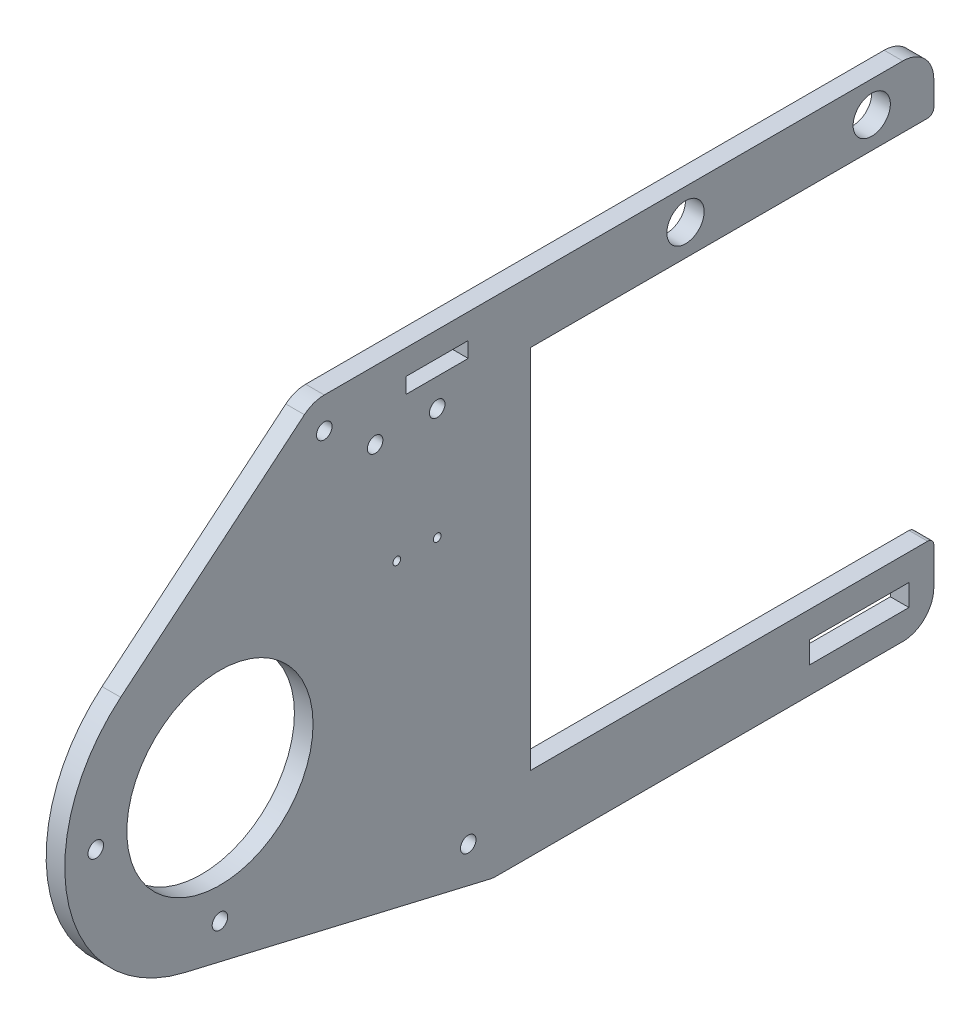
from build123d import *

# Parameters (mm, degrees)
SKETCH1_R           = 15
SKETCH1_R_2         = 3
SKETCH1_R_3         = 1.25
SKETCH1_R_4         = 0.625
SKETCH1_W           = 10
SKETCH1_H           = 2.5
SKETCH1_W_2         = 16
SKETCH1_H_2         = 3.5
BOSS_EXTRUDE1_DEPTH = 3
FILLET1_R           = 5
FILLET2_R           = 1


with BuildPart() as part:
    # Sketch1 → Boss-Extrude1 (new body)
    with BuildSketch(Plane(origin=(0, 0, 0), x_dir=(0, 0, -1), z_dir=(1, 0, 0))):
        with BuildLine():
            Line((0, 5), (65, 5))
            Line((65, 5), (65, 15))
            Line((65, 15), (-35, 15))
            Line((-35, 15), (-65.988977704, -10.781451876))
            ThreePointArc((-65.988977704, -10.781451876), (-74.331609313, -35.742193679), (-55.709440186, -54.339315783))
            Line((-55.709440186, -54.339315783), (-6, -66))
            Line((-6, -66), (65, -66))
            Line((65, -66), (65, -54))
            Line((65, -54), (0, -54))
            Line((0, -54), (0, 5))
        make_face()
        with Locations((-50, -30)):
            Circle(SKETCH1_R, mode=Mode.SUBTRACT)
        with Locations((55, 10)):
            Circle(SKETCH1_R_2, mode=Mode.SUBTRACT)
        with Locations((25, 10)):
            Circle(SKETCH1_R_2, mode=Mode.SUBTRACT)
        with Locations((-33.192050804, 10)):
            Circle(SKETCH1_R_3, mode=Mode.SUBTRACT)
        with Locations((-50, -50)):
            Circle(SKETCH1_R_3, mode=Mode.SUBTRACT)
        with Locations((-70, -30)):
            Circle(SKETCH1_R_3, mode=Mode.SUBTRACT)
        with Locations((-10, -59.255419511)):
            Circle(SKETCH1_R_3, mode=Mode.SUBTRACT)
        with Locations((-25, 4)):
            Circle(SKETCH1_R_3, mode=Mode.SUBTRACT)
        with Locations((-15, 4)):
            Circle(SKETCH1_R_3, mode=Mode.SUBTRACT)
        with Locations((-15, -14)):
            Circle(SKETCH1_R_4, mode=Mode.SUBTRACT)
        with Locations((-21.5, -14)):
            Circle(SKETCH1_R_4, mode=Mode.SUBTRACT)
        with Locations((-15, 9.75)):
            Rectangle(SKETCH1_W, SKETCH1_H, mode=Mode.SUBTRACT)
        with Locations((53, -60)):
            Rectangle(SKETCH1_W_2, SKETCH1_H_2, mode=Mode.SUBTRACT)
    extrude(amount=BOSS_EXTRUDE1_DEPTH)

    # Fillet1
    fillet1_edges = [part.edges().sort_by_distance(p)[0] for p in [
        (1.5, -66, -65),
        (1.5, -66, 6),
        (1.5, 15, 35),
        (1.5, 15, -65),
    ]]
    fillet(fillet1_edges, radius=FILLET1_R)

    # Fillet2
    fillet2_edges = [part.edges().sort_by_distance(p)[0] for p in [
        (1.5, 5, -65),
        (1.5, -54, -65),
    ]]
    fillet(fillet2_edges, radius=FILLET2_R)


solid = part.part
